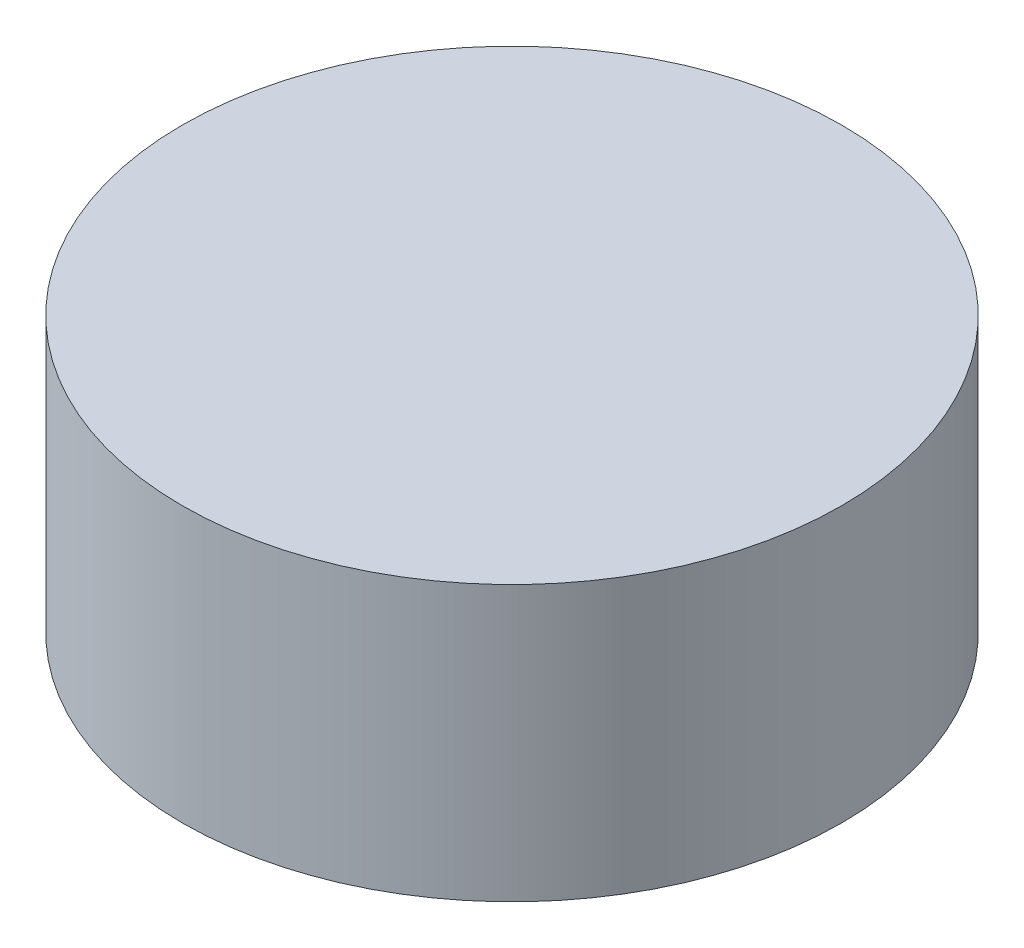
from build123d import *

# Parameters (mm, degrees)
SKETCH1_R           = 3
BOSS_EXTRUDE1_DEPTH = 2.5


with BuildPart() as part:
    # Sketch1 → Boss-Extrude1 (new body)
    with BuildSketch(Plane(origin=(0, 0, 0), x_dir=(1, 0, 0), z_dir=(0, 1, 0))):
        with Locations(Location((0, 0, 0), (0, 0, 270))):
            Circle(SKETCH1_R)
    extrude(amount=BOSS_EXTRUDE1_DEPTH)


solid = part.part
